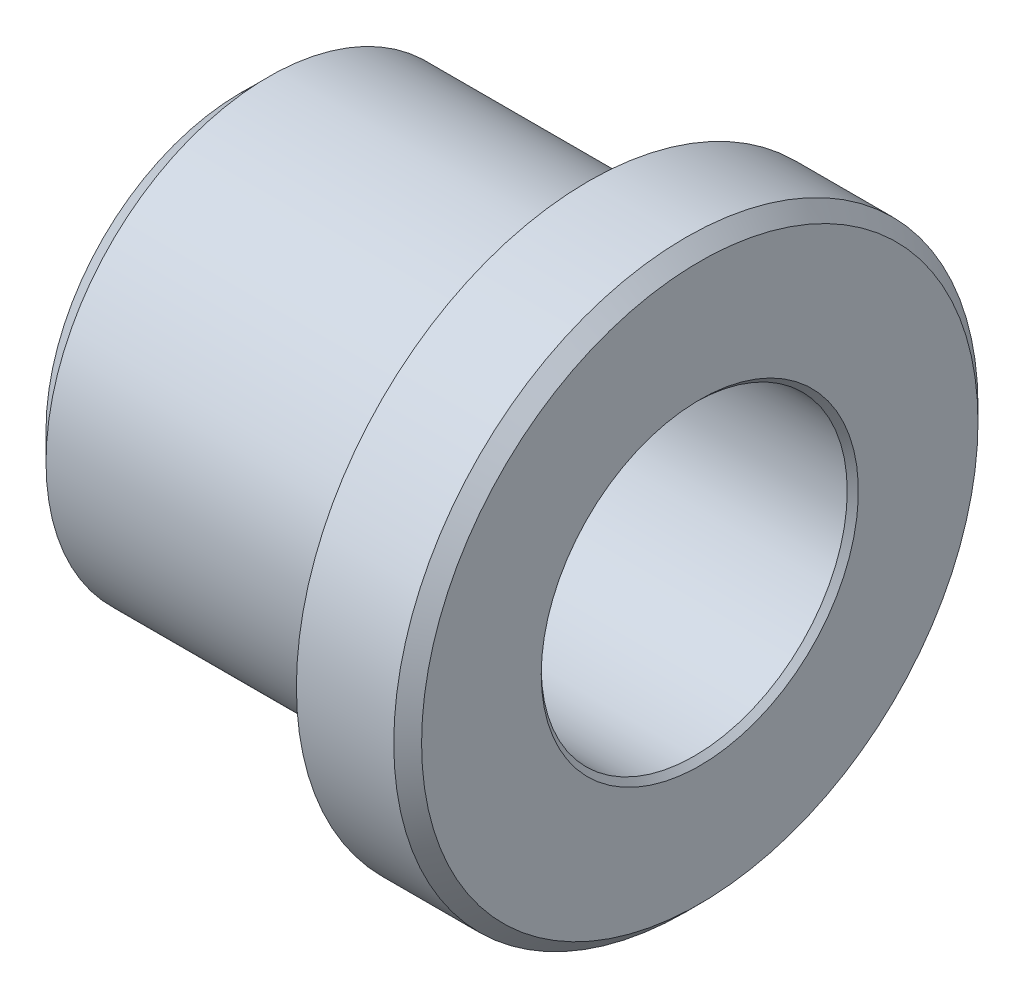
from build123d import *

# Parameters (mm, degrees)
CHANFREIN1_SIZE = 0.5
CHANFREIN2_SIZE = 1
CHANFREIN3_SIZE = 0.2


with BuildPart() as part:
    # Esquisse1 → Base-Révolution (revolve)
    with BuildSketch(Plane.XY, mode=Mode.PRIVATE) as base_r_volution_sk:
        Polygon((12.5, 10.5), (16.5, 10.5), (16.5, 5.5), (0, 5.5), (0, 8), (12.5, 8), align=None)
    revolve(base_r_volution_sk.sketch.rotate(Axis((11.390827922, 0, 0), (1, 0, 0)), 90), axis=Axis((11.390827922, 0, 0), (1, 0, 0)))

    # Chanfrein1
    chanfrein1_edges = [part.edges().sort_by_distance(p)[0] for p in [
        (16.5, 0, -10.5),
    ]]
    chamfer(chanfrein1_edges, length=CHANFREIN1_SIZE)

    # Chanfrein2
    chanfrein2_edges = [part.edges().sort_by_distance(p)[0] for p in [
        (0, 0, -8),
    ]]
    chamfer(chanfrein2_edges, length=CHANFREIN2_SIZE)

    # Chanfrein3
    chanfrein3_edges = [part.edges().sort_by_distance(p)[0] for p in [
        (0, 0, -5.5),
        (16.5, 0, -5.5),
    ]]
    chamfer(chanfrein3_edges, length=CHANFREIN3_SIZE)


solid = part.part
